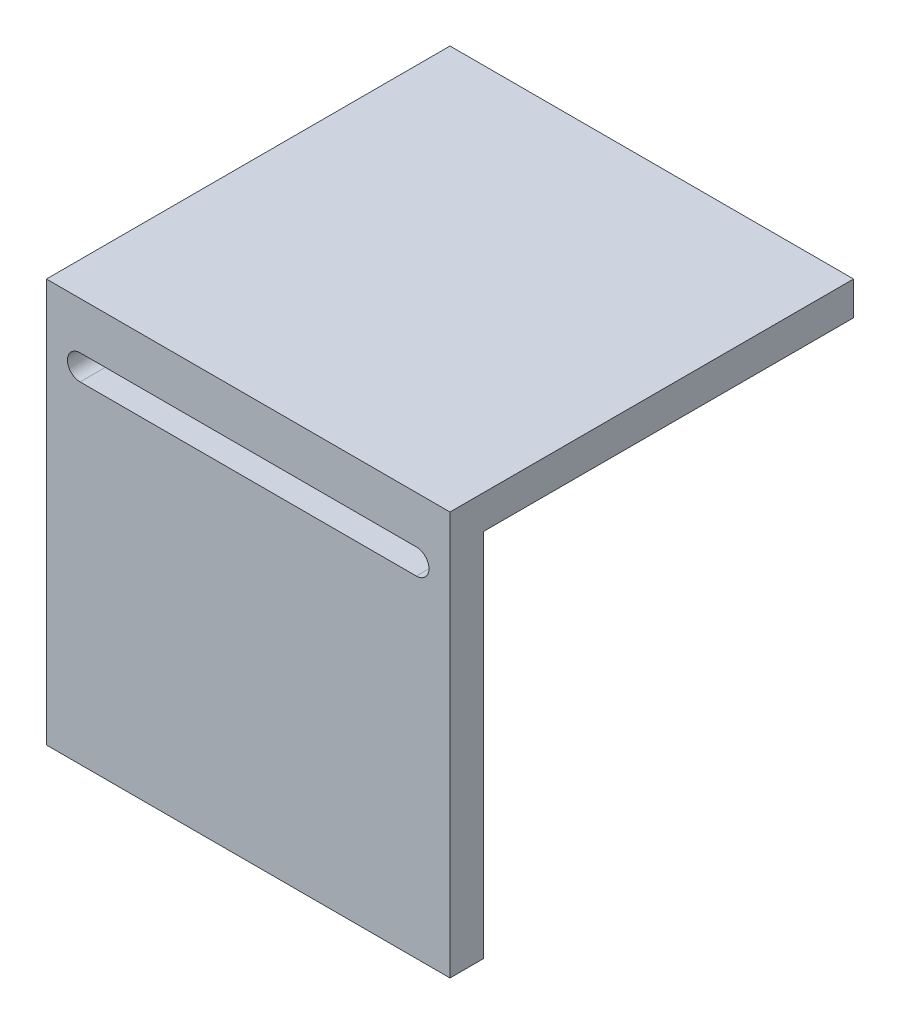
from build123d import *

# Parameters (mm, degrees)
BOSS_EXTRUDE1_DEPTH = 76.2
CUT_EXTRUDE3_DEPTH  = 129.420802443


with BuildPart() as part:
    # Sketch1 → Boss-Extrude1 (new body)
    with BuildSketch(Plane(origin=(0, 0, 0), x_dir=(0, 0, -1), z_dir=(1, 0, 0))):
        Polygon((-6.35, 76.2), (69.85, 76.2), (69.85, 69.85), (0, 69.85), (0, 0), (-6.35, 0), align=None)
    extrude(amount=BOSS_EXTRUDE1_DEPTH)

    # Sketch7 → Cut-Extrude3 (cut, through all)
    with BuildSketch(Plane(origin=(0, 0, 0), x_dir=(-1, 0, 0), z_dir=(0, 0, -1))):
        with BuildLine():
            Line((-69.85, 67.31), (-6.35, 67.31))
            ThreePointArc((-6.35, 67.31), (-3.96875, 64.92875), (-6.35, 62.5475))
            Line((-6.35, 62.5475), (-69.85, 62.5475))
            ThreePointArc((-69.85, 62.5475), (-72.23125, 64.92875), (-69.85, 67.31))
        make_face()
    extrude(amount=-CUT_EXTRUDE3_DEPTH, mode=Mode.SUBTRACT)


solid = part.part
